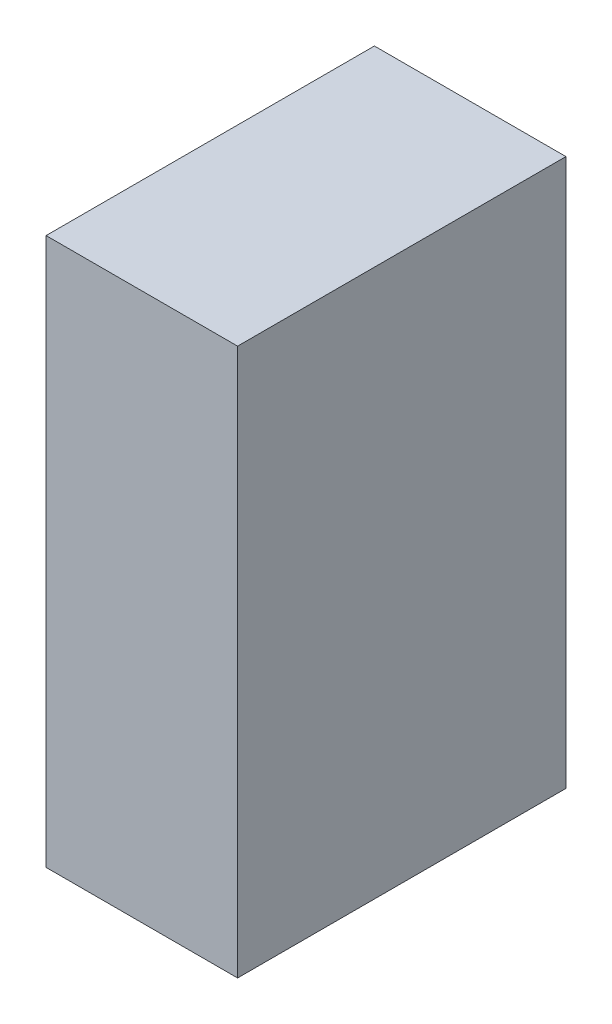
from build123d import *

# Parameters (mm, degrees)
PACK_PANO_SERVO_SURUCU_3_1_START = -188
SKETCH1_W                        = 35
SKETCH1_H                        = 100
PACK_PANO_SERVO_SURUCU_3_1_DEPTH = 60


with BuildPart() as part:
    # Sketch1 → PACK_pano_servo_surucu_3_1 (new body)
    with BuildSketch(Plane.XY.offset(PACK_PANO_SERVO_SURUCU_3_1_START)):
        with Locations((627.5, 230)):
            Rectangle(SKETCH1_W, SKETCH1_H)
    extrude(amount=-PACK_PANO_SERVO_SURUCU_3_1_DEPTH)


solid = part.part
